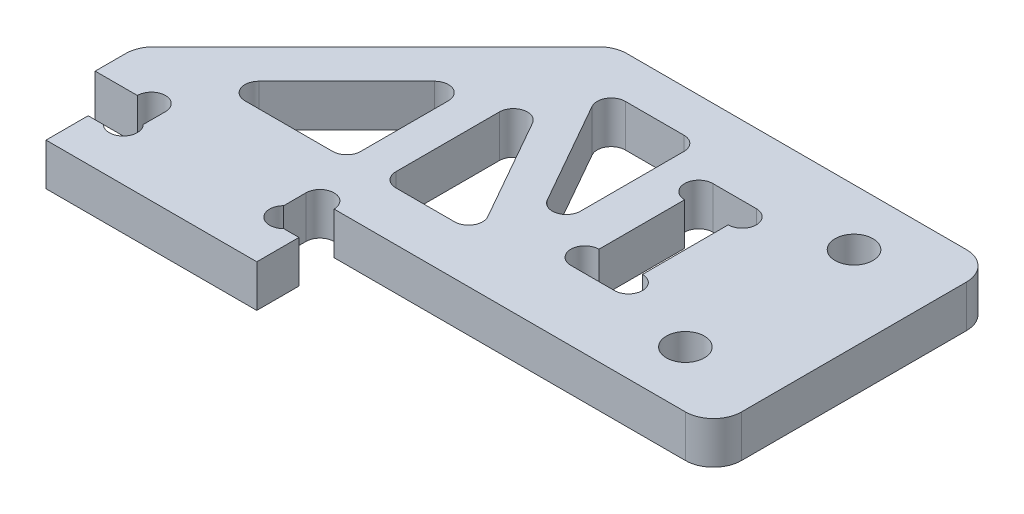
from build123d import *

# Parameters (mm, degrees)
EXTRUDE_1_DEPTH     = 3
SKETCH_2_R          = 1.35
SKETCH_2_W          = 3.1
SKETCH_2_H          = 10.1
CUT_EXTRUDE_1_DEPTH = 49.425200051
SKETCH_5_W          = 15
SKETCH_5_H          = 3
EXTRUDE_2_DEPTH     = 3
SKETCH_3_R          = 1
CUT_EXTRUDE_2_DEPTH = 49.425200051
CUT_EXTRUDE_3_DEPTH = 10
FILLET_1_R          = 1
FILLET_2_R          = 2


with BuildPart() as part:
    # 草图1 → 凸台-拉伸1 (new body)
    with BuildSketch(Plane(origin=(0, 0, 0), x_dir=(1, 0, 0), z_dir=(0, 1, 0))):
        Polygon((0, 0), (5, 0), (5, -3), (15, -3), (15, 0), (44, 0), (44, 20), (17, 20), (0, 3), align=None)
    extrude(amount=EXTRUDE_1_DEPTH)

    # 草图2 → 切除-拉伸1 (cut, through all)
    with BuildSketch(Plane.XZ):
        with Locations(Location((38, -16, 0), (0, 0, 270))):
            Circle(SKETCH_2_R)
        with Locations(Location((38, -4, 0), (0, 0, 90))):
            Circle(SKETCH_2_R)
        with Locations((30.45, -10)):
            Rectangle(SKETCH_2_W, SKETCH_2_H)
    extrude(amount=-CUT_EXTRUDE_1_DEPTH, mode=Mode.SUBTRACT)

    # 草图5 → 凸台-拉伸2 (add)
    with BuildSketch(Plane(origin=(0, 3, 0), x_dir=(1, 0, 0), z_dir=(0, 1, 0))):
        with Locations((10, -4.5)):
            Rectangle(SKETCH_5_W, SKETCH_5_H)
    extrude(amount=-EXTRUDE_2_DEPTH)

    # 草图3 → 切除-拉伸2 (cut, through all)
    with BuildSketch(Plane.XZ):
        with Locations((32, -14.05)):
            Circle(SKETCH_3_R)
        with Locations((16, 0)):
            Circle(SKETCH_3_R)
        with Locations((4, 0)):
            Circle(SKETCH_3_R)
        with Locations((32, -5.95)):
            Circle(SKETCH_3_R)
        with Locations((28.9, -5.95)):
            Circle(SKETCH_3_R)
        with Locations((28.9, -14.05)):
            Circle(SKETCH_3_R)
        with Locations((4.292893219, 2.292893219)):
            Circle(SKETCH_3_R)
        with Locations((15.707106781, 2.292893219)):
            Circle(SKETCH_3_R)
    extrude(amount=-CUT_EXTRUDE_2_DEPTH, mode=Mode.SUBTRACT)

    # 草图4 → 切除-拉伸3 (cut)
    with BuildSketch(Plane(origin=(0, 3, 0), x_dir=(1, 0, 0), z_dir=(0, 1, 0))):
        Polygon((23.789631314, 3.5), (16.896065397, 15.65342471), (16.896065397, 3.5), align=None)
        Polygon((14.396065397, 3.5), (14.396065397, 13.15342471), (4.742640687, 3.5), align=None)
        Polygon((25.9, 4.84657529), (25.9, 17), (19.006434083, 17), align=None)
    extrude(amount=-CUT_EXTRUDE_3_DEPTH, mode=Mode.SUBTRACT)

    # 圆角1
    fillet_1_edges = [part.edges().sort_by_distance(p)[0] for p in [
        (19.006434083, 1.5, -17),
        (25.9, 1.5, -17),
        (25.9, 1.5, -4.84657529),
        (14.396065397, 1.5, -13.15342471),
        (14.396065397, 1.5, -3.5),
        (4.742640687, 1.5, -3.5),
        (16.896065397, 1.5, -15.65342471),
        (23.789631314, 1.5, -3.5),
        (16.896065397, 1.5, -3.5),
    ]]
    fillet(fillet_1_edges, radius=FILLET_1_R)

    # 圆角2
    fillet_2_edges = [part.edges().sort_by_distance(p)[0] for p in [
        (0, 1.5, -3),
        (17, 1.5, -20),
        (44, 1.5, -20),
        (44, 1.5, 0),
    ]]
    fillet(fillet_2_edges, radius=FILLET_2_R)


solid = part.part
